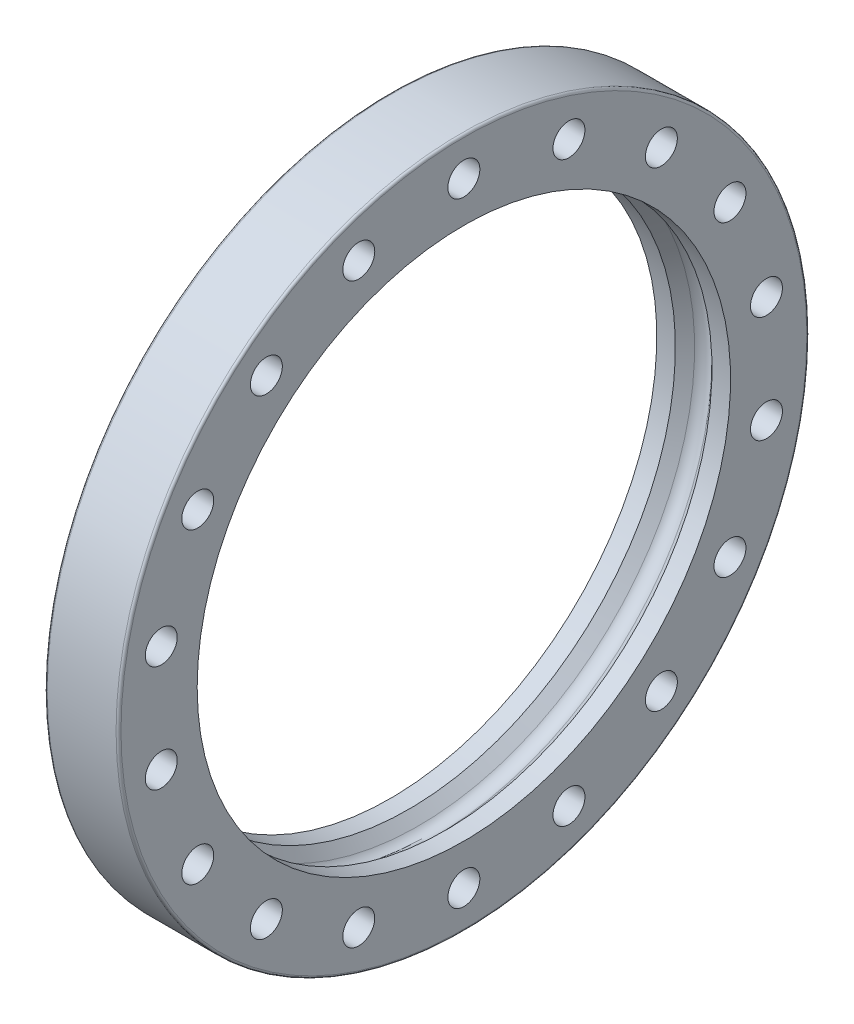
from build123d import *

# Parameters (mm, degrees)
FILLET1_R          = 1
FILLET2_R          = 5
SKETCH2_R          = 6.5
CUT_EXTRUDE2_DEPTH = 201.948998659
CIRPATTERN1_COUNT  = 18


with BuildPart() as part:
    # Sketch1 → Revolve1 (revolve)
    with BuildSketch(Plane.XY):
        Polygon((-7.442388155, 108.5), (0, 115.942388155), (7.442388155, 108.5), (15, 108.5), (15, 140.5), (-15, 140.5), (-15, 108.5), align=None)
    revolve(axis=Axis((0, 0, 0), (1, 0, 0)))

    # Fillet1
    fillet1_edges = [part.edges().sort_by_distance(p)[0] for p in [
        (15, -140.5, 0),
        (-15, -140.5, 0),
    ]]
    fillet(fillet1_edges, radius=FILLET1_R)

    # Fillet2
    fillet2_edges = [part.edges().sort_by_distance(p)[0] for p in [
        (0, -115.942388155, 0),
    ]]
    fillet(fillet2_edges, radius=FILLET2_R)

    # Sketch2 → Cut-Extrude2 (cut, through all)
    with BuildSketch(Plane(origin=(15, 0, 0), x_dir=(0, 0, -1), z_dir=(1, 0, 0))):
        with Locations((0, 125)):
            Circle(SKETCH2_R)
    cut_extrude2 = extrude(amount=-CUT_EXTRUDE2_DEPTH, mode=Mode.SUBTRACT)

    # CirPattern1: Cut-Extrude2 ×18 about axis
    cirpattern1_axis = Axis((14, 0, 0), (-1, 0, 0))
    for i in range(1, CIRPATTERN1_COUNT):
        add(cut_extrude2.rotate(cirpattern1_axis, i * 360 / CIRPATTERN1_COUNT), mode=Mode.SUBTRACT)


solid = part.part
